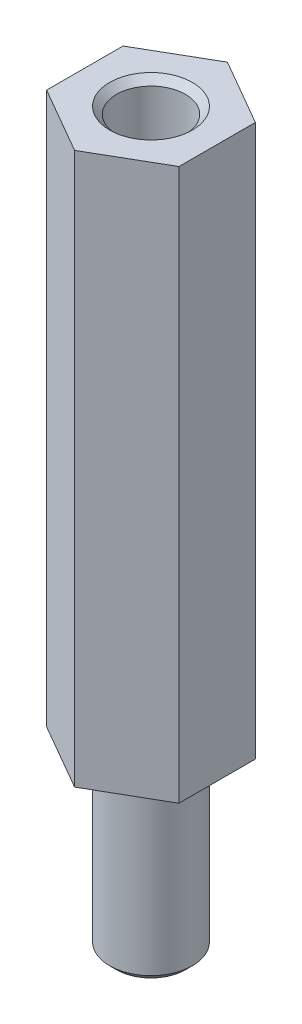
from build123d import *

# Parameters (mm, degrees)
SPACER_DEPTH       = 20
HOLE_R             = 1.25
BLIND_HOLE_DEPTH   = 6.5
HOLE_CHAMFER_SIZE  = 0.25
SHAFT_R            = 1.5
MAIL_SHAFT_DEPTH   = 6.5
SHAFT_CHAMFER_SIZE = 0.25


with BuildPart() as part:
    # Profile → SPACER (new body)
    with BuildSketch(Plane(origin=(0, 0, 0), x_dir=(1, 0, 0), z_dir=(0, 1, 0))):
        Polygon((-2.4, -1.385640646), (0, -2.771281292), (2.4, -1.385640646), (2.4, 1.385640646), (0, 2.771281292), (-2.4, 1.385640646), align=None)
    extrude(amount=SPACER_DEPTH)

    # HOLE → BLIND_HOLE (cut)
    with BuildSketch(Plane(origin=(0, 20, 0), x_dir=(1, 0, 0), z_dir=(0, 1, 0))):
        with Locations(Location((0, 0, 0), (0, 0, 270))):
            Circle(HOLE_R)
    extrude(amount=-BLIND_HOLE_DEPTH, mode=Mode.SUBTRACT)

    # HOLE_Chamfer
    hole_chamfer_edges = [part.edges().sort_by_distance(p)[0] for p in [
        (0, 20, -1.25),
    ]]
    chamfer(hole_chamfer_edges, length=HOLE_CHAMFER_SIZE)

    # Sketch6 → DRILL_CUT (revolve, cut)
    with BuildSketch(Plane.XY, mode=Mode.PRIVATE) as drill_cut_sk:
        Polygon((0, 13.5), (-1.25, 13.5), (0, 12.748924226), align=None)
    revolve(drill_cut_sk.sketch.rotate(Axis((0, 12.748924226, 0), (0, 1, 0)), 90), axis=Axis((0, 12.748924226, 0), (0, 1, 0)), mode=Mode.SUBTRACT)

    # SHAFT → MAIL_SHAFT (add)
    with BuildSketch(Plane.XZ):
        with Locations(Location((0, 0, 0), (0, 0, 90))):
            Circle(SHAFT_R)
    extrude(amount=MAIL_SHAFT_DEPTH)

    # SHAFT_Chamfer
    shaft_chamfer_edges = [part.edges().sort_by_distance(p)[0] for p in [
        (0, -6.5, -1.5),
    ]]
    chamfer(shaft_chamfer_edges, length=SHAFT_CHAMFER_SIZE)


solid = part.part
